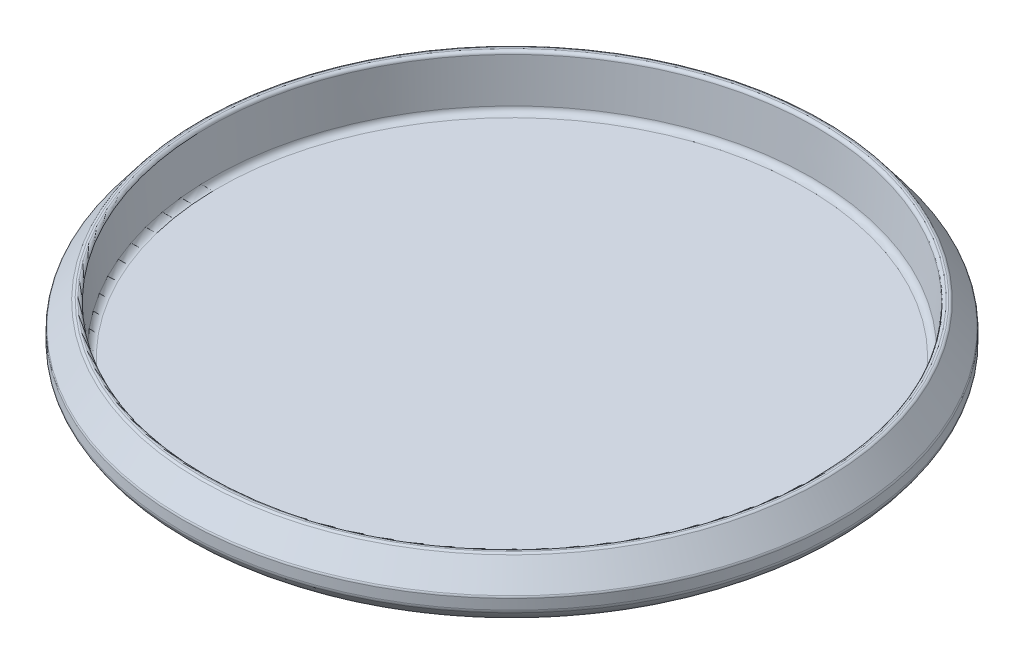
from build123d import *

# Parameters (mm, degrees)
SKETCH1_R           = 95
BOSS_EXTRUDE1_DEPTH = 1.5
FILLET1_R           = 1
FILLET2_R           = 1
FILLET4_R           = 2
FILLET5_R           = 2


with BuildPart() as part:
    # Sketch1 → Boss-Extrude1 (new body)
    with BuildSketch(Plane(origin=(0, 0, 0), x_dir=(1, 0, 0), z_dir=(0, 1, 0))):
        with Locations(Location((0, 0, 0), (0, 0, 270))):
            Circle(SKETCH1_R)
    extrude(amount=BOSS_EXTRUDE1_DEPTH)

    # Sketch2 → Revolve1 (revolve)
    with BuildSketch(Plane.XY, mode=Mode.PRIVATE) as revolve1_sk:
        with BuildLine():
            Line((95, 1.5), (96.40419305, 17.55))
            Line((96.40419305, 17.55), (98.40419305, 17.55))
            Line((98.40419305, 17.55), (104.461103858, 9.593001102))
            Line((104.461103858, 9.593001102), (104.461103858, 5.593001102))
            ThreePointArc((104.461103858, 5.593001102), (100.616111366, 1.298490869), (95, 0))
            Line((95, 0), (95, 1.5))
        make_face()
    revolve(revolve1_sk.sketch.rotate(Axis((0, 0, 0), (0, 1, 0)), 90), axis=Axis((0, 0, 0), (0, 1, 0)))

    # Fillet1
    fillet1_edges = [part.edges().sort_by_distance(p)[0] for p in [
        (0, 17.55, 98.40419305),
        (0, 17.55, 96.40419305),
    ]]
    fillet(fillet1_edges, radius=FILLET1_R)

    # Fillet2
    fillet2_edges = [part.edges().sort_by_distance(p)[0] for p in [
        (0, 9.593001102, 104.461103858),
    ]]
    fillet(fillet2_edges, radius=FILLET2_R)

    # Fillet4
    fillet4_edges = [part.edges().sort_by_distance(p)[0] for p in [
        (0, 5.593001102, 104.461103858),
    ]]
    fillet(fillet4_edges, radius=FILLET4_R)

    # Fillet5
    fillet5_edges = [part.edges().sort_by_distance(p)[0] for p in [
        (0, 1.5, 95),
    ]]
    fillet(fillet5_edges, radius=FILLET5_R)


solid = part.part
